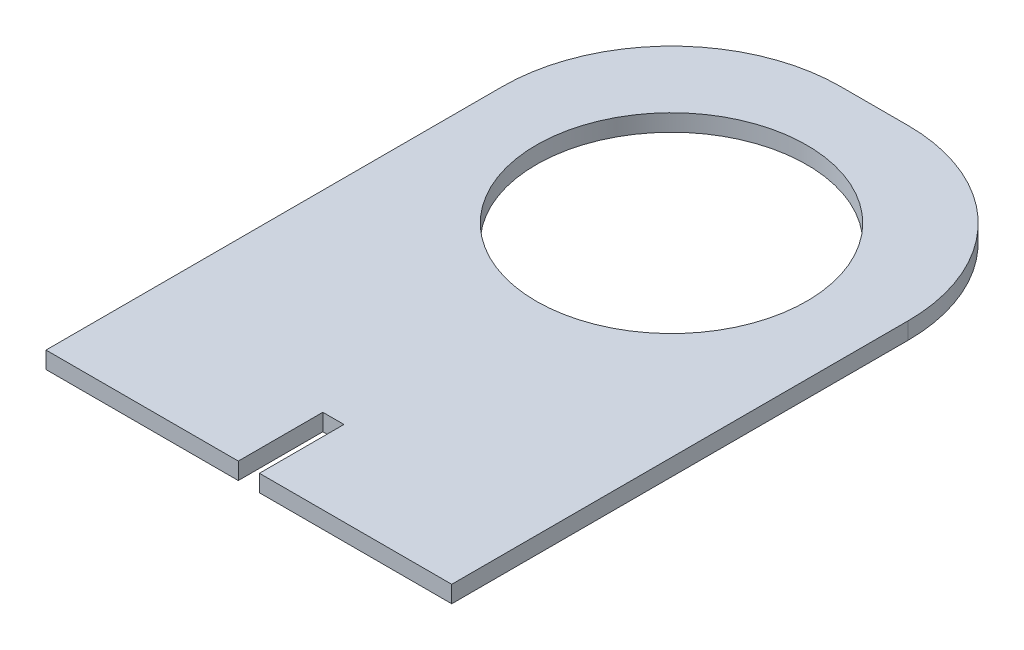
from build123d import *

# Parameters (mm, degrees)
SKETCH1_R           = 20.32
BOSS_EXTRUDE1_DEPTH = 2.54
FILLET1_R           = 25.4


with BuildPart() as part:
    # Sketch1 → Boss-Extrude1 (new body)
    with BuildSketch(Plane(origin=(0, 0, 0), x_dir=(1, 0, 0), z_dir=(0, 1, 0))):
        Polygon((-30.48, 30.48), (-30.48, -63.5), (-1.5875, -63.5), (-1.5875, -50.8), (1.5875, -50.8), (1.5875, -63.5), (30.48, -63.5), (30.48, 30.48), align=None)
        with Locations(Location((0, 0, 0), (0, 0, 270))):
            Circle(SKETCH1_R, mode=Mode.SUBTRACT)
    extrude(amount=BOSS_EXTRUDE1_DEPTH)

    # Fillet1
    fillet1_edges = [part.edges().sort_by_distance(p)[0] for p in [
        (-30.48, 1.27, -30.48),
        (30.48, 1.27, -30.48),
    ]]
    fillet(fillet1_edges, radius=FILLET1_R)


solid = part.part
